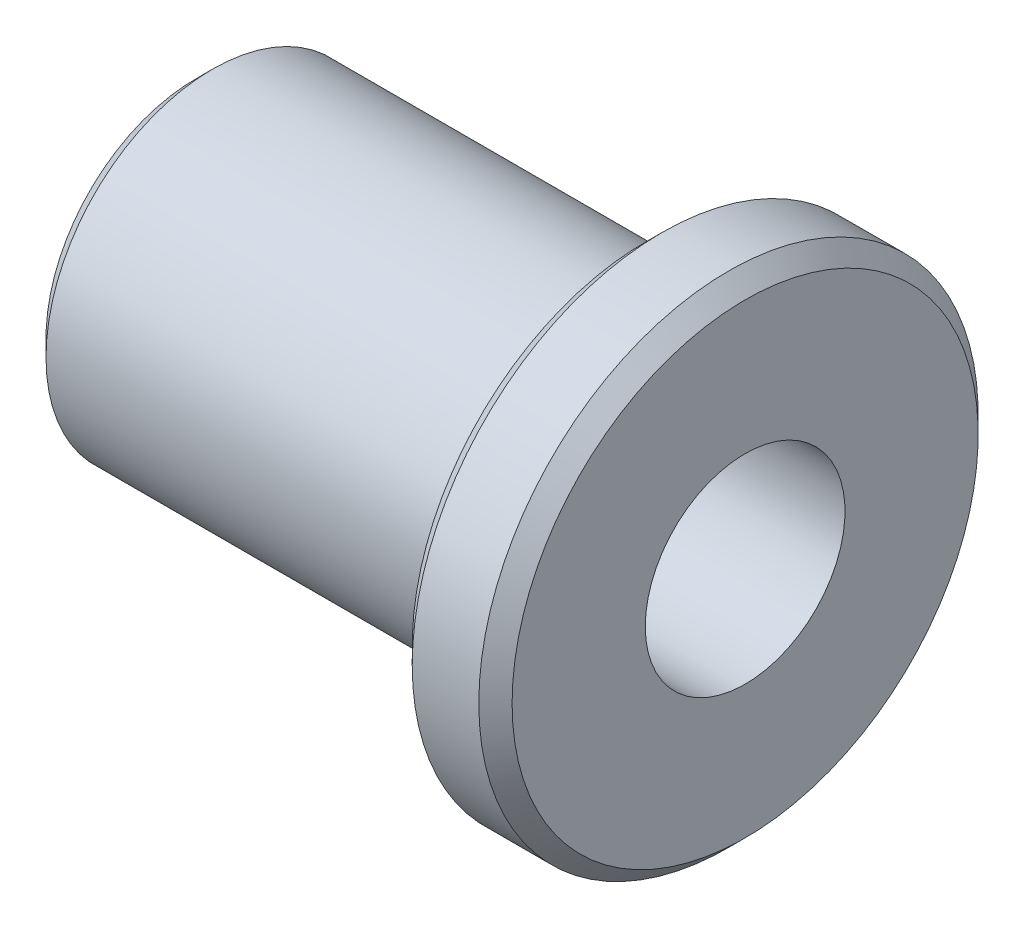
from build123d import *

# Parameters (mm, degrees)
CHANFREIN1_SIZE = 0.5


with BuildPart() as part:
    # Esquisse1 → Base-Révolution (revolve)
    with BuildSketch(Plane.XY, mode=Mode.PRIVATE) as base_r_volution_sk:
        Polygon((0, 3), (0, 5), (13.5, 5), (13.5, 7.5), (16.5, 7.5), (16.5, 3), align=None)
    revolve(base_r_volution_sk.sketch.rotate(Axis((0, 0, 0), (1, 0, 0)), 90), axis=Axis((0, 0, 0), (1, 0, 0)))

    # Chanfrein1
    chanfrein1_edges = [part.edges().sort_by_distance(p)[0] for p in [
        (16.5, 0, -7.5),
        (13.5, 0, -7.5),
        (0, 0, -5),
        (0, 0, -3),
    ]]
    chamfer(chanfrein1_edges, length=CHANFREIN1_SIZE)


solid = part.part
